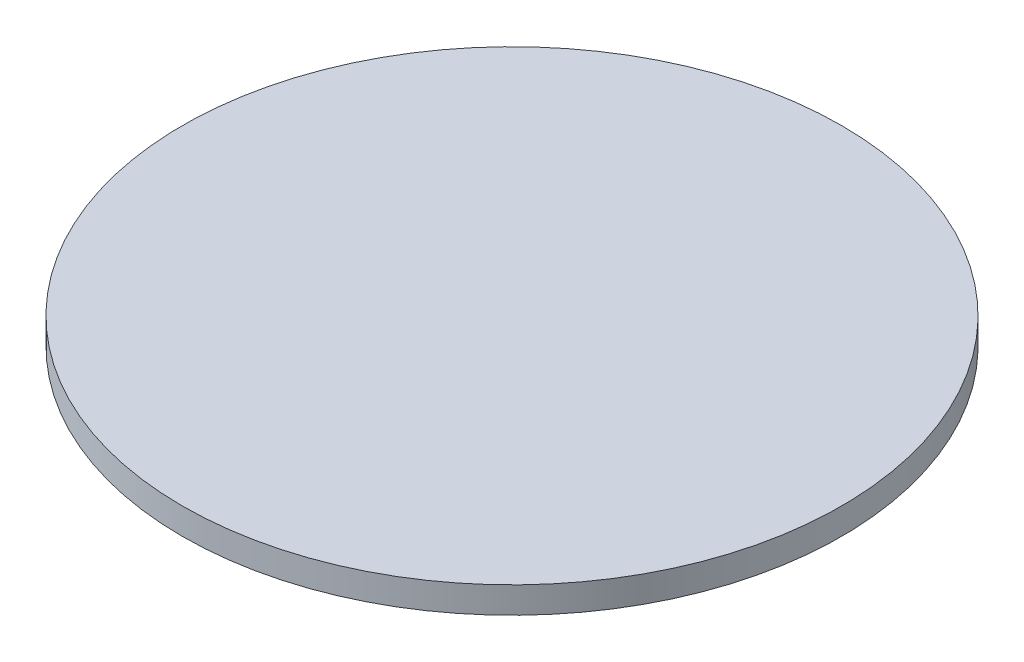
from build123d import *

# Parameters (mm, degrees)
SKETCH1_R           = 10
BOSS_EXTRUDE1_DEPTH = 0.8


with BuildPart() as part:
    # Sketch1 → Boss-Extrude1 (new body)
    with BuildSketch(Plane(origin=(0, 0, 0), x_dir=(1, 0, 0), z_dir=(0, 1, 0))):
        with Locations(Location((0, 0, 0), (0, 0, 270))):
            Circle(SKETCH1_R)
    extrude(amount=BOSS_EXTRUDE1_DEPTH)


solid = part.part
